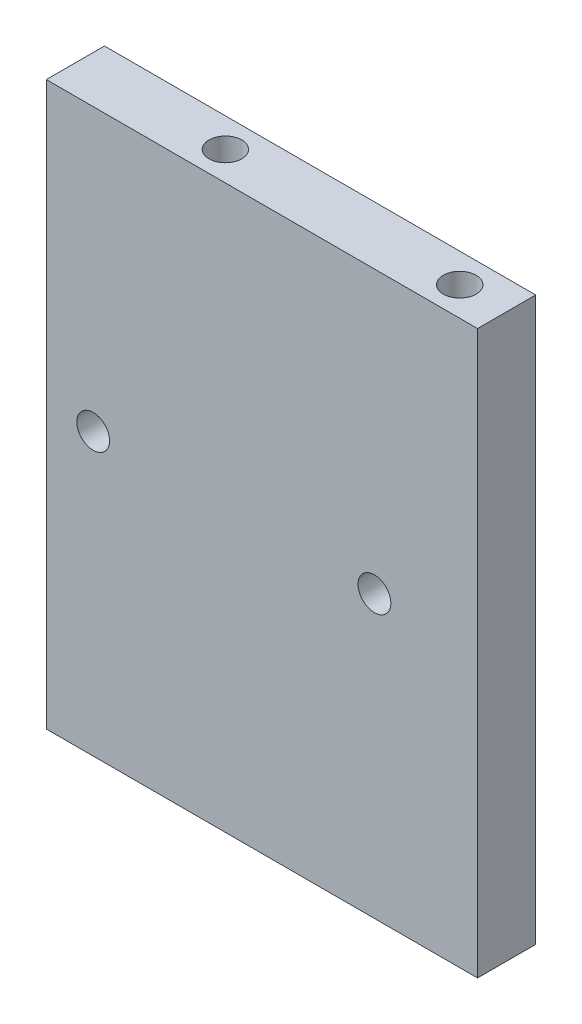
from build123d import *

# Parameters (mm, degrees)
SKETCH1_W         = 46
SKETCH1_H         = 60
EXTRUDE_1_4_DEPTH = 6.2
SKETCH2_R         = 1.75
M4_DRILL_DEPTH    = 6.2
SKETCH3_R         = 1.75
M4_DRILL2_DEPTH   = 8
M4_DRILL3_START   = -8
SKETCH4_R         = 1.75
M4_DRILL3_DEPTH   = 8


with BuildPart() as part:
    # Sketch1 → 1/4 (new body)
    with BuildSketch(Plane.XY):
        Rectangle(SKETCH1_W, SKETCH1_H)
    extrude(amount=EXTRUDE_1_4_DEPTH)

    # Sketch2 → M4_DRILL (cut)
    with BuildSketch(Plane.XY):
        with Locations((-18, 0)):
            Circle(SKETCH2_R)
        with Locations((12, 0)):
            Circle(SKETCH2_R)
    extrude(amount=M4_DRILL_DEPTH, mode=Mode.SUBTRACT)

    # Sketch3 → M4_DRILL2 (cut)
    with BuildSketch(Plane.XZ.offset(30)):
        with Locations(Location((-7, 3.1, 0), (0, 0, 270))):
            Circle(SKETCH3_R)
        with Locations(Location((18, 3.1, 0), (0, 0, 270))):
            Circle(SKETCH3_R)
    extrude(amount=-M4_DRILL2_DEPTH, mode=Mode.SUBTRACT)

    # Sketch4 → M4_DRILL3 (cut)
    with BuildSketch(Plane(origin=(0, 30, 0), x_dir=(1, 0, 0), z_dir=(0, 1, 0)).offset(M4_DRILL3_START)):
        with Locations(Location((18, -3.1, 0), (0, 0, 90))):
            Circle(SKETCH4_R)
        with Locations(Location((-7, -3.1, 0), (0, 0, 90))):
            Circle(SKETCH4_R)
    extrude(amount=M4_DRILL3_DEPTH, mode=Mode.SUBTRACT)


solid = part.part
